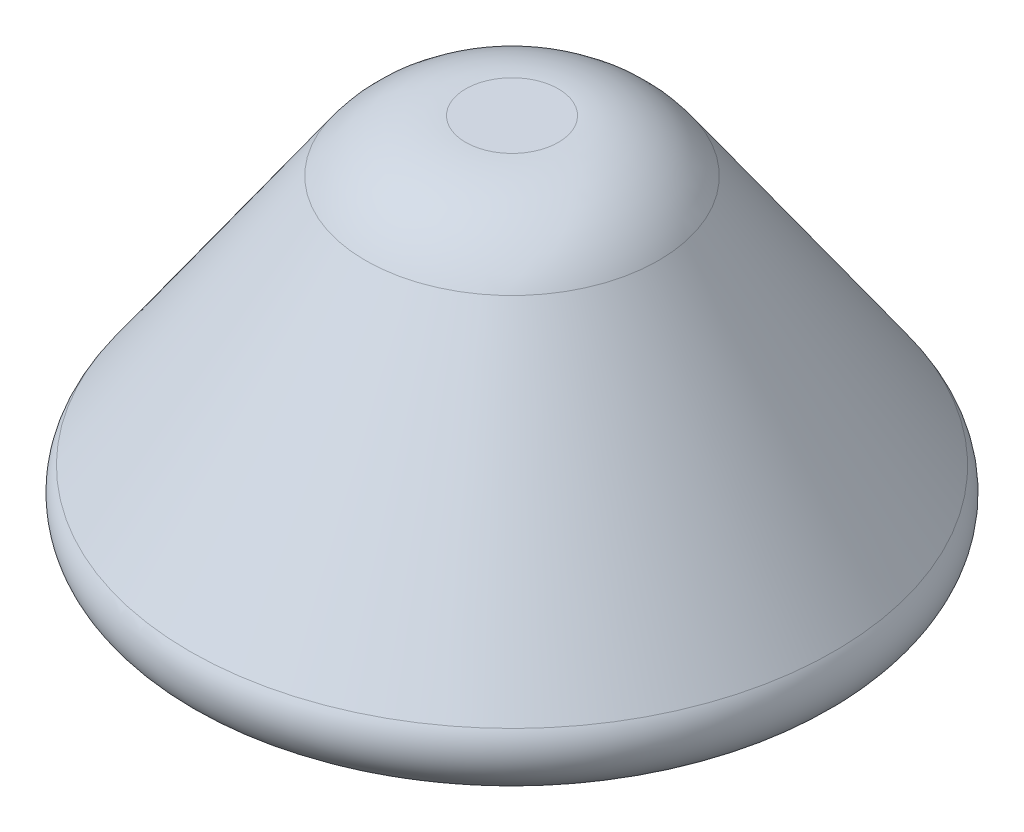
from build123d import *

# Parameters (mm, degrees)
SKETCH3_R           = 9
BOSS_EXTRUDE3_DEPTH = 9
BOSS_EXTRUDE3_TAPER = 35
FILLET1_R           = 3
FILLET2_R           = 1


with BuildPart() as part:
    # Sketch3 → Boss-Extrude3 (new body)
    with BuildSketch(Plane(origin=(0, 0, 0), x_dir=(1, 0, 0), z_dir=(0, 1, 0))):
        Circle(SKETCH3_R)
    extrude(amount=BOSS_EXTRUDE3_DEPTH, taper=BOSS_EXTRUDE3_TAPER)

    # Fillet1
    fillet1_edges = [part.edges().sort_by_distance(p)[0] for p in [
        (-2.698132156, 9, 0),
    ]]
    fillet(fillet1_edges, radius=FILLET1_R)

    # Fillet2
    fillet2_edges = [part.edges().sort_by_distance(p)[0] for p in [
        (-9, 0, 0),
    ]]
    fillet(fillet2_edges, radius=FILLET2_R)


solid = part.part
